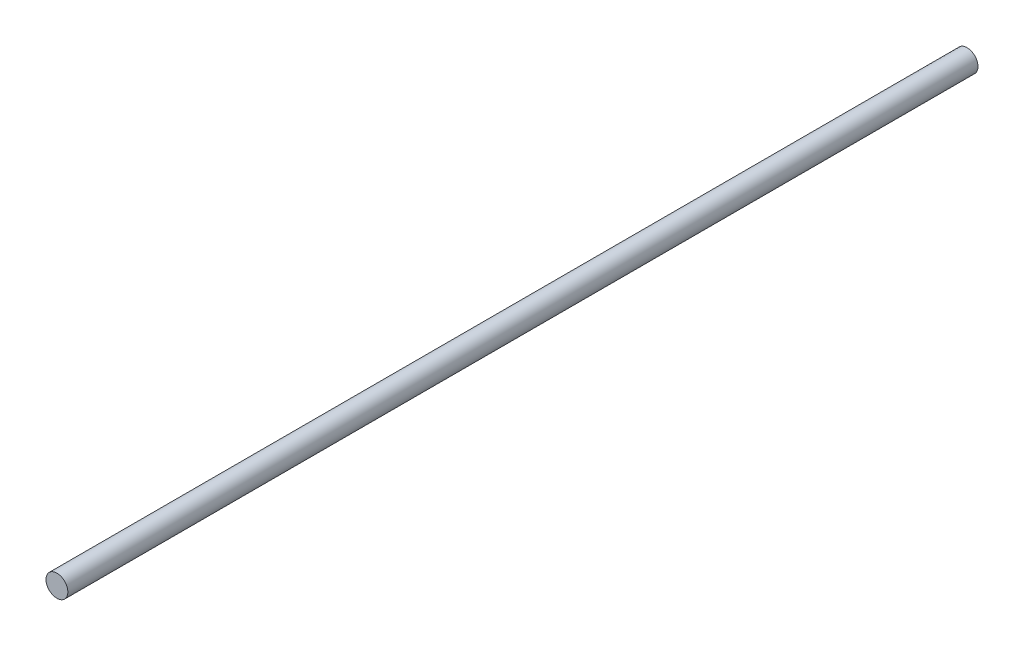
from build123d import *

# Parameters (mm, degrees)
SCHIZZO1_R                   = 6
ESTRUSIONE_ESTRUSIONE1_DEPTH = 500


with BuildPart() as part:
    # Schizzo1 → Estrusione-Estrusione1 (new body)
    with BuildSketch(Plane.XY):
        Circle(SCHIZZO1_R)
    extrude(amount=ESTRUSIONE_ESTRUSIONE1_DEPTH)


solid = part.part
